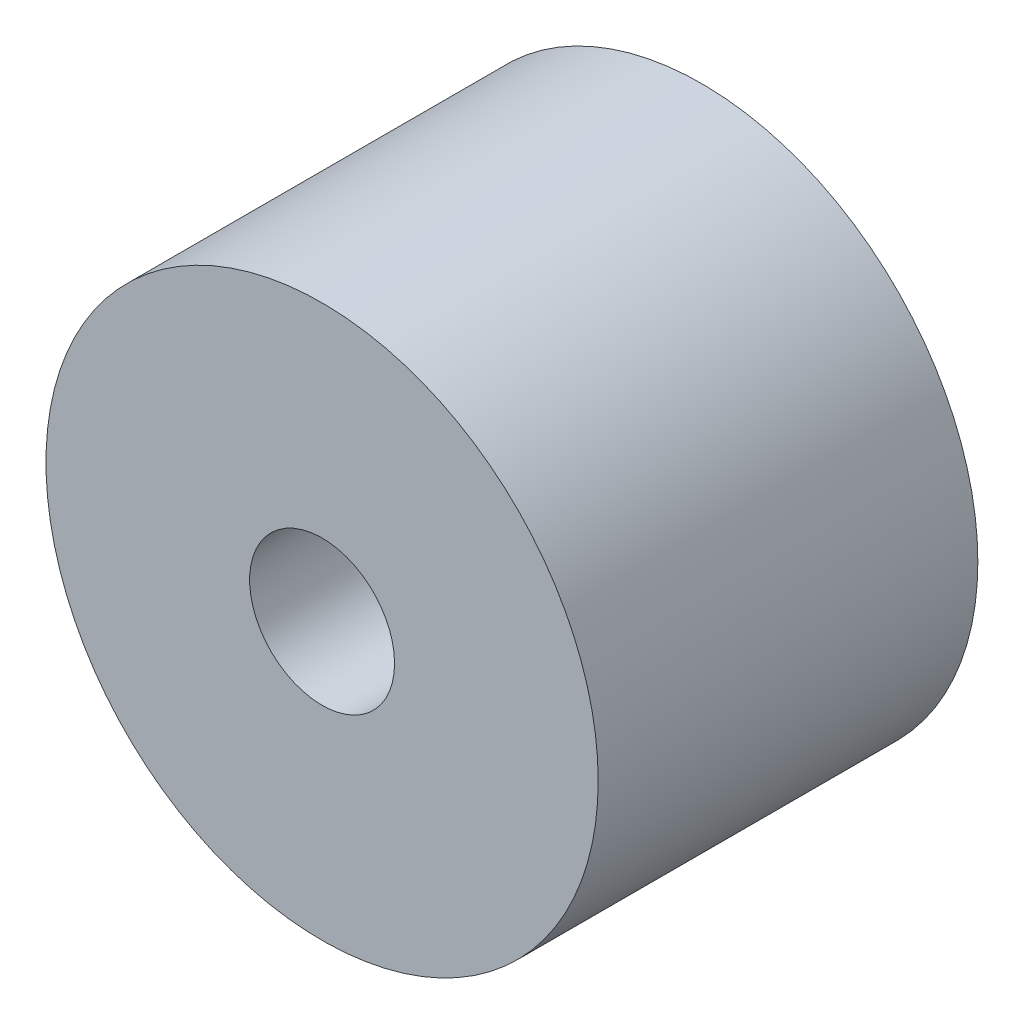
from build123d import *

# Parameters (mm, degrees)
SKETCH_1_R      = 4
SKETCH_1_R_2    = 1.05
EXTRUDE_1_DEPTH = 5.5


with BuildPart() as part:
    # ｽｹｯﾁ1 → ﾎﾞｽ - 押し出し1 (new body)
    with BuildSketch(Plane.XY):
        Circle(SKETCH_1_R)
        Circle(SKETCH_1_R_2, mode=Mode.SUBTRACT)
    extrude(amount=EXTRUDE_1_DEPTH)


solid = part.part
